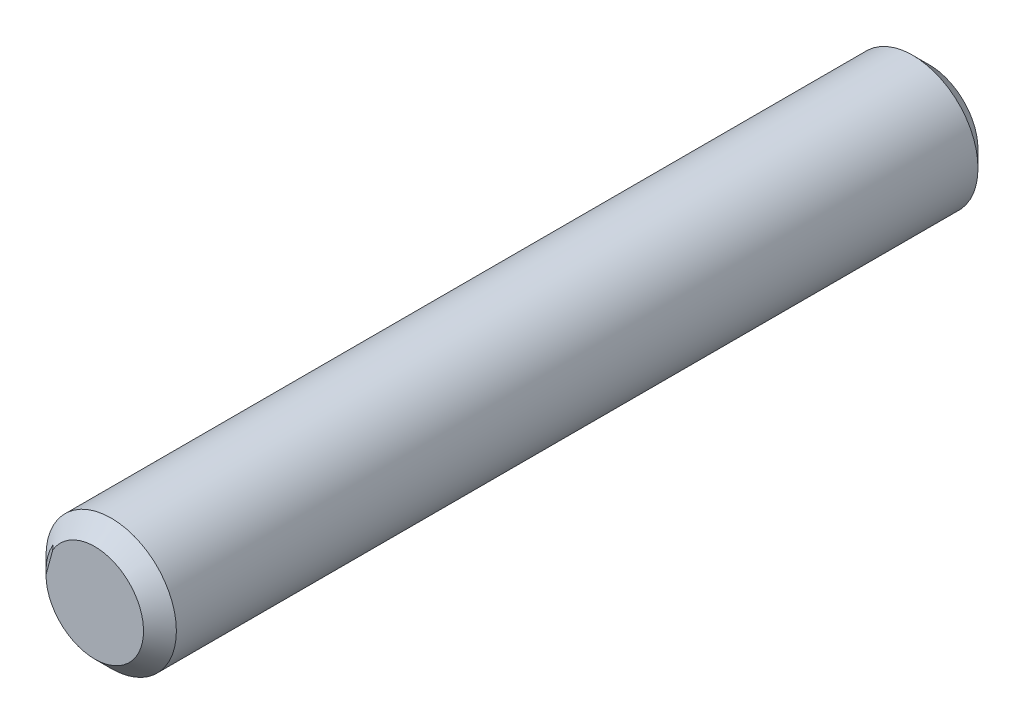
from build123d import *

# Parameters (mm, degrees)
SKETCH1_R           = 1.984375
BOSS_EXTRUDE1_DEPTH = 12.7
CHAMFER1_SIZE       = 0.5
CUT_EXTRUDE2_DEPTH  = 0.1


with BuildPart() as part:
    # Sketch1 → Boss-Extrude1 (new, symmetric)
    with BuildSketch(Plane.XY):
        Circle(SKETCH1_R)
    extrude(amount=BOSS_EXTRUDE1_DEPTH, both=True)

    # Chamfer1
    chamfer1_edges = [part.edges().sort_by_distance(p)[0] for p in [
        (-1.984375, 0, -12.7),
        (-1.984375, 0, 12.7),
    ]]
    chamfer(chamfer1_edges, length=CHAMFER1_SIZE)

    # Sketch2 → Cut-Extrude2 (cut)
    with BuildSketch(Plane.XY.offset(12.7)):
        with BuildLine():
            ThreePointArc((-1.278959217, 0.753413872), (-1.432100595, 0.390457458), (-1.484375, 0))
            Line((-1.484375, 0), (-1.278959217, 0.753413872))
        make_face()
        with BuildLine():
            Line((-1.775379716, 0.079341467), (-1.484375, 0))
            ThreePointArc((-1.484375, 0), (-1.432100595, 0.390457458), (-1.278959217, 0.753413872))
            Line((-1.278959217, 0.753413872), (-1.569963933, 0.832755339))
            Line((-1.569963933, 0.832755339), (-1.775379716, 0.079341467))
        make_face()
    extrude(amount=-CUT_EXTRUDE2_DEPTH, mode=Mode.SUBTRACT)


solid = part.part
